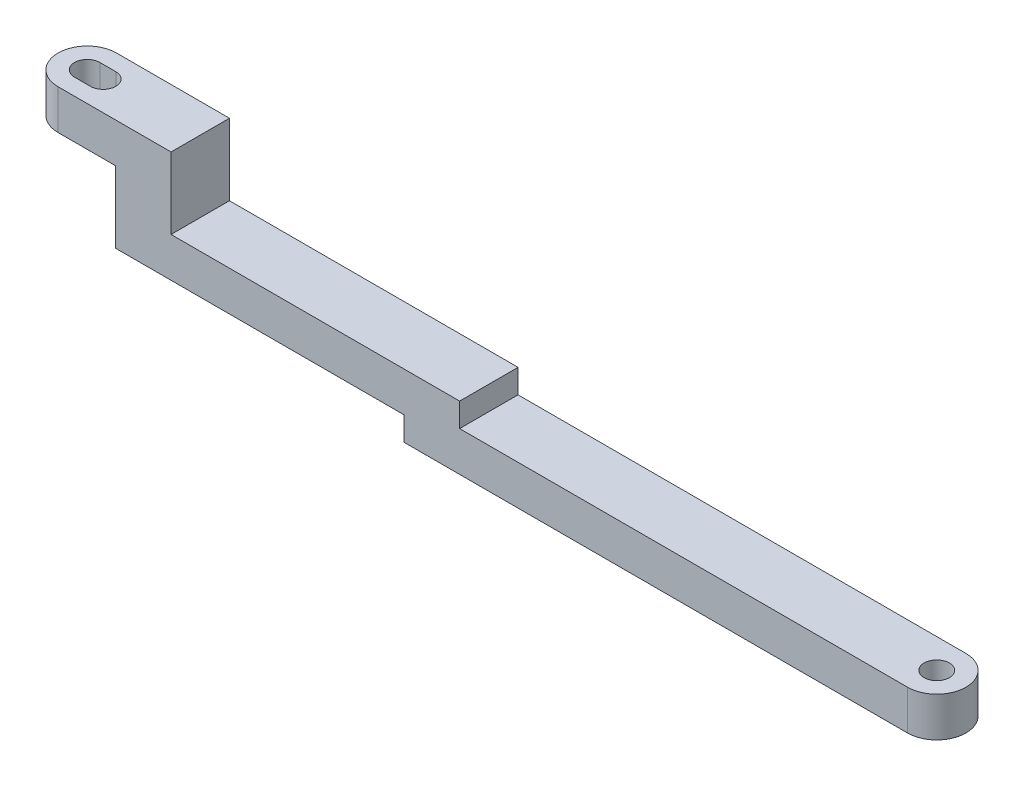
from build123d import *

# Parameters (mm, degrees)
SKETCH1_R           = 1.6
BOSS_EXTRUDE1_DEPTH = 5
BOSS_EXTRUDE2_START = -14
BOSS_EXTRUDE2_DEPTH = 5
CUT_EXTRUDE1_DEPTH  = 5
SKETCH2_4_W         = 7
SKETCH2_4_H         = 7.36
BOSS_EXTRUDE3_DEPTH = 14
BOSS_EXTRUDE4_START = -2
SKETCH3_R           = 1.6
BOSS_EXTRUDE4_DEPTH = 5
SKETCH3_3_R         = 1.6
CUT_EXTRUDE2_DEPTH  = 112.622599862
SKETCH3_4_W         = 7
SKETCH3_4_H         = 7.36
BOSS_EXTRUDE5_DEPTH = 3


with BuildPart() as part:
    # Sketch1 → Boss-Extrude1 (new body)
    with BuildSketch(Plane(origin=(0, 0, 0), x_dir=(1, 0, 0), z_dir=(0, 1, 0))):
        with BuildLine():
            Line((0, 3.68), (107, 3.68))
            ThreePointArc((107, 3.68), (110.68, 0), (107, -3.68))
            Line((107, -3.68), (0, -3.68))
            ThreePointArc((0, -3.68), (-3.68, 0), (0, 3.68))
        make_face()
        with Locations(Location((107, 0, 0), (0, 0, 270))):
            Circle(SKETCH1_R, mode=Mode.SUBTRACT)
        with BuildLine():
            Line((0, 1.6), (2, 1.6))
            ThreePointArc((2, 1.6), (3.6, 0), (2, -1.6))
            Line((2, -1.6), (0, -1.6))
            ThreePointArc((0, -1.6), (-1.6, 0), (0, 1.6))
        make_face(mode=Mode.SUBTRACT)
    extrude(amount=BOSS_EXTRUDE1_DEPTH)

    # Sketch2<3> → Cut-Extrude1 (cut)
    with BuildSketch(Plane.XZ):
        with BuildLine():
            ThreePointArc((0, 3.68), (-3.68, 0), (0, -3.68))
            Line((0, -3.68), (7.234142504, -3.68))
            Line((7.234142504, -3.68), (7.234142504, 3.68))
            Line((7.234142504, 3.68), (0, 3.68))
        make_face()
        with BuildLine():
            ThreePointArc((0, -1.6), (-1.6, 0), (0, 1.6))
            Line((0, 1.6), (2, 1.6))
            ThreePointArc((2, 1.6), (3.6, 0), (2, -1.6))
            Line((2, -1.6), (0, -1.6))
        make_face(mode=Mode.SUBTRACT)
    extrude(amount=-CUT_EXTRUDE1_DEPTH, mode=Mode.SUBTRACT)



with BuildPart() as body_2:
    # Sketch2 → Boss-Extrude2 (new body)
    with BuildSketch(Plane.XZ.offset(BOSS_EXTRUDE2_START)):
        with BuildLine():
            ThreePointArc((0, 3.68), (-3.68, 0), (0, -3.68))
            Line((0, -3.68), (7.234142504, -3.68))
            Line((7.234142504, -3.68), (7.234142504, 3.68))
            Line((7.234142504, 3.68), (0, 3.68))
        make_face()
        with BuildLine():
            ThreePointArc((0, -1.6), (-1.6, 0), (0, 1.6))
            Line((0, 1.6), (2, 1.6))
            ThreePointArc((2, 1.6), (3.6, 0), (2, -1.6))
            Line((2, -1.6), (0, -1.6))
        make_face(mode=Mode.SUBTRACT)
    extrude(amount=BOSS_EXTRUDE2_DEPTH)


with BuildPart() as part_1:
    add(part.part)

    add(body_2.part)  # Boss-Extrude3 merges body 2
    # Sketch2<4> → Boss-Extrude3 (add)
    with BuildSketch(Plane.XZ):
        with Locations((10.734142504, 0)):
            Rectangle(SKETCH2_4_W, SKETCH2_4_H)
    extrude(amount=-BOSS_EXTRUDE3_DEPTH)

    # Sketch3<3> → Cut-Extrude2 (cut, through all)
    # profile 1 of 2: a face of its own
    with BuildSketch(Plane.XZ):
        with BuildLine():
            ThreePointArc((110.68, 0), (109.602152955, 2.602152955), (107, 3.68))
            ThreePointArc((107, 3.68), (103.32, 0), (107, -3.68))
            ThreePointArc((107, -3.68), (109.602152955, -2.602152955), (110.68, 0))
        make_face()
        with Locations((107, 0)):
            Circle(SKETCH3_3_R, mode=Mode.SUBTRACT)
    # profile 2 of 2: a face of its own
    with BuildSketch(Plane.XZ):
        with BuildLine():
            ThreePointArc((107, -3.68), (103.32, 0), (107, 3.68))
            Line((107, 3.68), (50.58268169, 3.68))
            Line((50.58268169, 3.68), (50.58268169, -3.68))
            Line((50.58268169, -3.68), (107, -3.68))
        make_face()
    extrude(amount=-CUT_EXTRUDE2_DEPTH, mode=Mode.SUBTRACT)



with BuildPart() as body_2_2:
    # Sketch3 → Boss-Extrude4 (new body)
    # profile 1 of 2: a face of its own
    with BuildSketch(Plane.XZ.offset(BOSS_EXTRUDE4_START)):
        with BuildLine():
            ThreePointArc((107, -3.68), (103.32, 0), (107, 3.68))
            Line((107, 3.68), (50.58268169, 3.68))
            Line((50.58268169, 3.68), (50.58268169, -3.68))
            Line((50.58268169, -3.68), (107, -3.68))
        make_face()
    # profile 2 of 2: a face of its own
    with BuildSketch(Plane.XZ.offset(BOSS_EXTRUDE4_START)):
        with BuildLine():
            ThreePointArc((110.68, 0), (109.602152955, 2.602152955), (107, 3.68))
            ThreePointArc((107, 3.68), (103.32, 0), (107, -3.68))
            ThreePointArc((107, -3.68), (109.602152955, -2.602152955), (110.68, 0))
        make_face()
        with Locations((107, 0)):
            Circle(SKETCH3_R, mode=Mode.SUBTRACT)
    extrude(amount=BOSS_EXTRUDE4_DEPTH)


with BuildPart() as part_2:
    add(part_1.part)

    add(body_2_2.part)  # Boss-Extrude5 merges body 2 2
    # Sketch3<4> → Boss-Extrude5 (add)
    with BuildSketch(Plane.XZ):
        with Locations((47.08268169, 0)):
            Rectangle(SKETCH3_4_W, SKETCH3_4_H)
    extrude(amount=BOSS_EXTRUDE5_DEPTH)


solid = part_2.part
